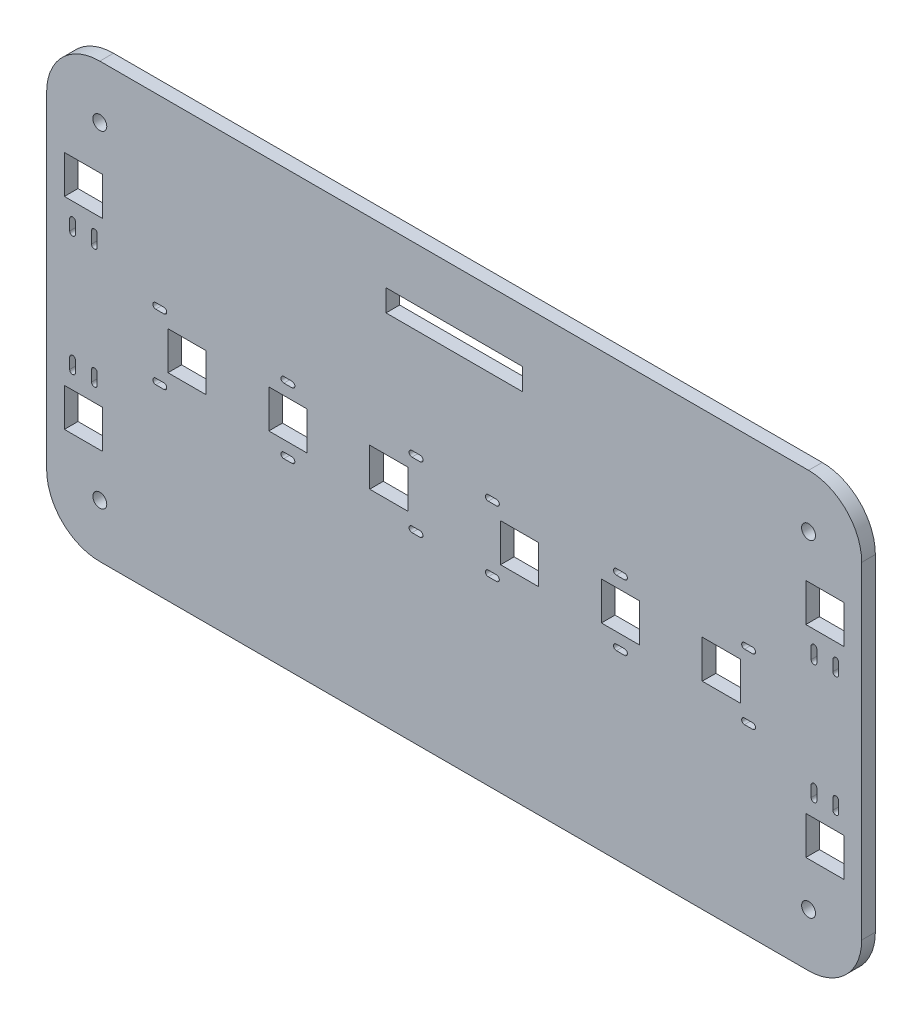
from build123d import *

# Parameters (mm, degrees)
SKETCH_2_R      = 2.55
SKETCH_2_W      = 14
SKETCH_2_H      = 14
SKETCH_2_W_2    = 50
SKETCH_2_H_2    = 8
EXTRUDE_1_DEPTH = 5


with BuildPart() as part:
    # 草图2 → 凸台-拉伸1 (new body)
    with BuildSketch(Plane.XY):
        with BuildLine():
            Line((-130, 29.5), (130, 29.5))
            ThreePointArc((130, 29.5), (143.788582233, 23.788582233), (149.5, 10))
            Line((149.5, 10), (149.5, -110))
            ThreePointArc((149.5, -110), (143.788582233, -123.788582233), (130, -129.5))
            Line((130, -129.5), (-130, -129.5))
            ThreePointArc((-130, -129.5), (-143.788582233, -123.788582233), (-149.5, -110))
            Line((-149.5, -110), (-149.5, 10))
            ThreePointArc((-149.5, 10), (-143.788582233, 23.788582233), (-130, 29.5))
        make_face()
        with Locations((130, -110)):
            Circle(SKETCH_2_R, mode=Mode.SUBTRACT)
        with Locations((130, 10)):
            Circle(SKETCH_2_R, mode=Mode.SUBTRACT)
        with Locations((-130, -110)):
            Circle(SKETCH_2_R, mode=Mode.SUBTRACT)
        with Locations((-130, 10)):
            Circle(SKETCH_2_R, mode=Mode.SUBTRACT)
        with Locations((-61, -50)):
            Rectangle(SKETCH_2_W, SKETCH_2_H, mode=Mode.SUBTRACT)
        with Locations((-24, -50)):
            Rectangle(SKETCH_2_W, SKETCH_2_H, mode=Mode.SUBTRACT)
        with Locations((24, -50)):
            Rectangle(SKETCH_2_W, SKETCH_2_H, mode=Mode.SUBTRACT)
        with Locations((136, -87)):
            Rectangle(SKETCH_2_W, SKETCH_2_H, mode=Mode.SUBTRACT)
        with Locations((136, -13)):
            Rectangle(SKETCH_2_W, SKETCH_2_H, mode=Mode.SUBTRACT)
        with Locations((0, 6)):
            Rectangle(SKETCH_2_W_2, SKETCH_2_H_2, mode=Mode.SUBTRACT)
        with Locations((-136, -87)):
            Rectangle(SKETCH_2_W, SKETCH_2_H, mode=Mode.SUBTRACT)
        with Locations((-136, -13)):
            Rectangle(SKETCH_2_W, SKETCH_2_H, mode=Mode.SUBTRACT)
        with Locations((-98, -50)):
            Rectangle(SKETCH_2_W, SKETCH_2_H, mode=Mode.SUBTRACT)
        with Locations((61, -50)):
            Rectangle(SKETCH_2_W, SKETCH_2_H, mode=Mode.SUBTRACT)
        with Locations((98, -50)):
            Rectangle(SKETCH_2_W, SKETCH_2_H, mode=Mode.SUBTRACT)
        with BuildLine():
            Line((133.05, -25.838987573), (133.05, -30.161012427))
            ThreePointArc((133.05, -30.161012427), (132, -31.211012427), (130.95, -30.161012427))
            Line((130.95, -30.161012427), (130.95, -25.838987573))
            ThreePointArc((130.95, -25.838987573), (132, -24.788987573), (133.05, -25.838987573))
        make_face(mode=Mode.SUBTRACT)
        with BuildLine():
            Line((141.05, -26), (141.05, -30))
            ThreePointArc((141.05, -30), (140, -31.05), (138.95, -30))
            Line((138.95, -30), (138.95, -26))
            ThreePointArc((138.95, -26), (140, -24.95), (141.05, -26))
        make_face(mode=Mode.SUBTRACT)
        with BuildLine():
            Line((130.95, -74), (130.95, -70))
            ThreePointArc((130.95, -70), (132, -68.95), (133.05, -70))
            Line((133.05, -70), (133.05, -74))
            ThreePointArc((133.05, -74), (132, -75.05), (130.95, -74))
        make_face(mode=Mode.SUBTRACT)
        with BuildLine():
            Line((138.95, -74), (138.95, -70))
            ThreePointArc((138.95, -70), (140, -68.95), (141.05, -70))
            Line((141.05, -70), (141.05, -74))
            ThreePointArc((141.05, -74), (140, -75.05), (138.95, -74))
        make_face(mode=Mode.SUBTRACT)
        with BuildLine():
            Line((-141.05, -26), (-141.05, -30))
            ThreePointArc((-141.05, -30), (-140, -31.05), (-138.95, -30))
            Line((-138.95, -30), (-138.95, -26))
            ThreePointArc((-138.95, -26), (-140, -24.95), (-141.05, -26))
        make_face(mode=Mode.SUBTRACT)
        with BuildLine():
            Line((-133.05, -25.838987573), (-133.05, -30.161012427))
            ThreePointArc((-133.05, -30.161012427), (-132, -31.211012427), (-130.95, -30.161012427))
            Line((-130.95, -30.161012427), (-130.95, -25.838987573))
            ThreePointArc((-130.95, -25.838987573), (-132, -24.788987573), (-133.05, -25.838987573))
        make_face(mode=Mode.SUBTRACT)
        with BuildLine():
            Line((-130.95, -74), (-130.95, -70))
            ThreePointArc((-130.95, -70), (-132, -68.95), (-133.05, -70))
            Line((-133.05, -70), (-133.05, -74))
            ThreePointArc((-133.05, -74), (-132, -75.05), (-130.95, -74))
        make_face(mode=Mode.SUBTRACT)
        with BuildLine():
            Line((-138.95, -74), (-138.95, -70))
            ThreePointArc((-138.95, -70), (-140, -68.95), (-141.05, -70))
            Line((-141.05, -70), (-141.05, -74))
            ThreePointArc((-141.05, -74), (-140, -75.05), (-138.95, -74))
        make_face(mode=Mode.SUBTRACT)
        with BuildLine():
            Line((-62.5, -36.95), (-59.5, -36.95))
            ThreePointArc((-59.5, -36.95), (-58.45, -38), (-59.5, -39.05))
            Line((-59.5, -39.05), (-62.5, -39.05))
            ThreePointArc((-62.5, -39.05), (-63.55, -38), (-62.5, -36.95))
        make_face(mode=Mode.SUBTRACT)
        with BuildLine():
            Line((-62.5, -60.95), (-59.5, -60.95))
            ThreePointArc((-59.5, -60.95), (-58.45, -62), (-59.5, -63.05))
            Line((-59.5, -63.05), (-62.5, -63.05))
            ThreePointArc((-62.5, -63.05), (-63.55, -62), (-62.5, -60.95))
        make_face(mode=Mode.SUBTRACT)
        with BuildLine():
            Line((-15.5, -60.95), (-12.5, -60.95))
            ThreePointArc((-12.5, -60.95), (-11.45, -62), (-12.5, -63.05))
            Line((-12.5, -63.05), (-15.5, -63.05))
            ThreePointArc((-15.5, -63.05), (-16.55, -62), (-15.5, -60.95))
        make_face(mode=Mode.SUBTRACT)
        with BuildLine():
            Line((-12.5, -39.05), (-15.5, -39.05))
            ThreePointArc((-15.5, -39.05), (-16.55, -38), (-15.5, -36.95))
            Line((-15.5, -36.95), (-12.5, -36.95))
            ThreePointArc((-12.5, -36.95), (-11.45, -38), (-12.5, -39.05))
        make_face(mode=Mode.SUBTRACT)
        with BuildLine():
            Line((-109.5, -36.95), (-106.5, -36.95))
            ThreePointArc((-106.5, -36.95), (-105.45, -38), (-106.5, -39.05))
            Line((-106.5, -39.05), (-109.5, -39.05))
            ThreePointArc((-109.5, -39.05), (-110.55, -38), (-109.5, -36.95))
        make_face(mode=Mode.SUBTRACT)
        with BuildLine():
            Line((-109.5, -60.95), (-106.5, -60.95))
            ThreePointArc((-106.5, -60.95), (-105.45, -62), (-106.5, -63.05))
            Line((-106.5, -63.05), (-109.5, -63.05))
            ThreePointArc((-109.5, -63.05), (-110.55, -62), (-109.5, -60.95))
        make_face(mode=Mode.SUBTRACT)
        with BuildLine():
            Line((109.5, -36.95), (106.5, -36.95))
            ThreePointArc((106.5, -36.95), (105.45, -38), (106.5, -39.05))
            Line((106.5, -39.05), (109.5, -39.05))
            ThreePointArc((109.5, -39.05), (110.55, -38), (109.5, -36.95))
        make_face(mode=Mode.SUBTRACT)
        with BuildLine():
            Line((109.5, -60.95), (106.5, -60.95))
            ThreePointArc((106.5, -60.95), (105.45, -62), (106.5, -63.05))
            Line((106.5, -63.05), (109.5, -63.05))
            ThreePointArc((109.5, -63.05), (110.55, -62), (109.5, -60.95))
        make_face(mode=Mode.SUBTRACT)
        with BuildLine():
            Line((62.5, -60.95), (59.5, -60.95))
            ThreePointArc((59.5, -60.95), (58.45, -62), (59.5, -63.05))
            Line((59.5, -63.05), (62.5, -63.05))
            ThreePointArc((62.5, -63.05), (63.55, -62), (62.5, -60.95))
        make_face(mode=Mode.SUBTRACT)
        with BuildLine():
            Line((15.5, -60.95), (12.5, -60.95))
            ThreePointArc((12.5, -60.95), (11.45, -62), (12.5, -63.05))
            Line((12.5, -63.05), (15.5, -63.05))
            ThreePointArc((15.5, -63.05), (16.55, -62), (15.5, -60.95))
        make_face(mode=Mode.SUBTRACT)
        with BuildLine():
            Line((62.5, -36.95), (59.5, -36.95))
            ThreePointArc((59.5, -36.95), (58.45, -38), (59.5, -39.05))
            Line((59.5, -39.05), (62.5, -39.05))
            ThreePointArc((62.5, -39.05), (63.55, -38), (62.5, -36.95))
        make_face(mode=Mode.SUBTRACT)
        with BuildLine():
            Line((12.5, -39.05), (15.5, -39.05))
            ThreePointArc((15.5, -39.05), (16.55, -38), (15.5, -36.95))
            Line((15.5, -36.95), (12.5, -36.95))
            ThreePointArc((12.5, -36.95), (11.45, -38), (12.5, -39.05))
        make_face(mode=Mode.SUBTRACT)
    extrude(amount=EXTRUDE_1_DEPTH)


solid = part.part
